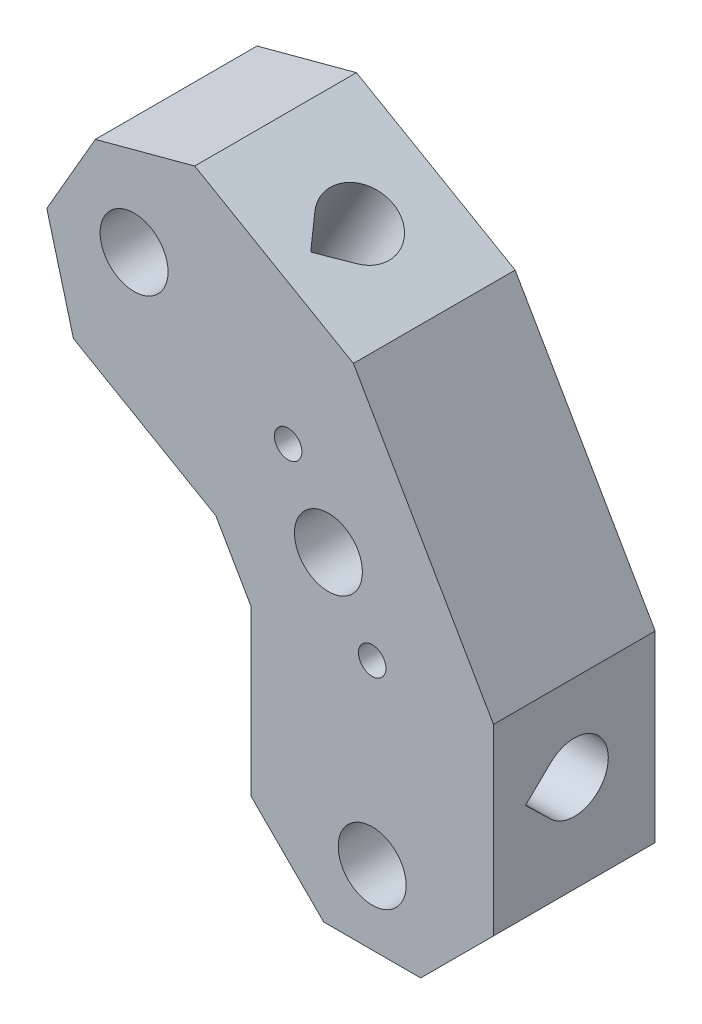
from build123d import *

# Parameters (mm, degrees)
BOSS_EXTRUDE1_DEPTH = 20
CUT_EXTRUDE1_DEPTH  = 59.888175724
CUT_EXTRUDE2_DEPTH  = 79.101263393
HOLE1_D             = 3.4
HOLE2_D             = 3.4
HOLE3_D             = 8.4
HOLE4_D             = 8.4
HOLE5_D             = 8.4
CHAMFER1_SIZE       = 8.485281374
CHAMFER2_SIZE       = 5
CHAMFER3_SIZE       = 8.485281374


with BuildPart() as part:
    # Sketch1 → Boss-Extrude1 (new body)
    with BuildSketch(Plane.XY.offset(20)):
        Polygon((15, -34), (15, -11.339745962), (-2.320508076, 18.660254038), (-21.944863729, 29.990381057), (-42.435244785, 24.5), (-36.944863729, 4.009618943), (-15, -8.660254038), (-15, -34), (0, -49), align=None)
    extrude(amount=-BOSS_EXTRUDE1_DEPTH)

    # Sketch2 → Cut-Extrude1 (cut, through all)
    with BuildSketch(Plane(origin=(-7.5, -12.990381057, 0), x_dir=(0.8660254037844394, -0.499999999999999, 0), z_dir=(-0.499999999999999, -0.8660254037844394, 0))):
        with BuildLine():
            Line((-18.978772839, 12.917565156), (-22, 16.046137466))
            Line((-22, 16.046137466), (-25.021227161, 12.917565156))
            ThreePointArc((-25.021227161, 12.917565156), (-22, 5.8), (-18.978772839, 12.917565156))
        make_face()
    extrude(amount=-CUT_EXTRUDE1_DEPTH, mode=Mode.SUBTRACT)

    # Sketch3 → Cut-Extrude2 (cut, through all)
    with BuildSketch(Plane(origin=(15, 0, 0), x_dir=(0, 0, -1), z_dir=(1, 0, 0))):
        with BuildLine():
            Line((-12.917565156, -18.978772839), (-16.046137466, -22))
            Line((-16.046137466, -22), (-12.917565156, -25.021227161))
            ThreePointArc((-12.917565156, -25.021227161), (-5.8, -22), (-12.917565156, -18.978772839))
        make_face()
    extrude(amount=-CUT_EXTRUDE2_DEPTH, mode=Mode.SUBTRACT)

    # Hole1 (through all)
    with Locations(Plane.XY.offset(20)):
        with Locations((0, -12)):
            Hole(HOLE1_D / 2)

    # Hole2 (through all)
    with Locations(Plane.XY.offset(20)):
        with Locations((-10.392304845, 6)):
            Hole(HOLE2_D / 2)

    # Hole3 (through all)
    with Locations(Plane.XY.offset(20)):
        with Locations((-5.412658774, -3.125)):
            Hole(HOLE3_D / 2)

    # Hole4 (through all)
    with Locations(Plane.XY.offset(20)):
        with Locations((-29.444863729, 17)):
            Hole(HOLE4_D / 2)

    # Hole5 (through all)
    with Locations(Plane.XY.offset(20)):
        with Locations((0, -34)):
            Hole(HOLE5_D / 2)

    # Chamfer1
    chamfer1_edges = [part.edges().sort_by_distance(p)[0] for p in [
        (-42.435244785, 24.5, 10),
    ]]
    chamfer(chamfer1_edges, length=CHAMFER1_SIZE)

    # Chamfer2
    chamfer2_edges = [part.edges().sort_by_distance(p)[0] for p in [
        (-15, -8.660254038, 10),
    ]]
    chamfer(chamfer2_edges, length=CHAMFER2_SIZE)

    # Chamfer3
    chamfer3_edges = [part.edges().sort_by_distance(p)[0] for p in [
        (0, -49, 10),
    ]]
    chamfer(chamfer3_edges, length=CHAMFER3_SIZE)


solid = part.part
